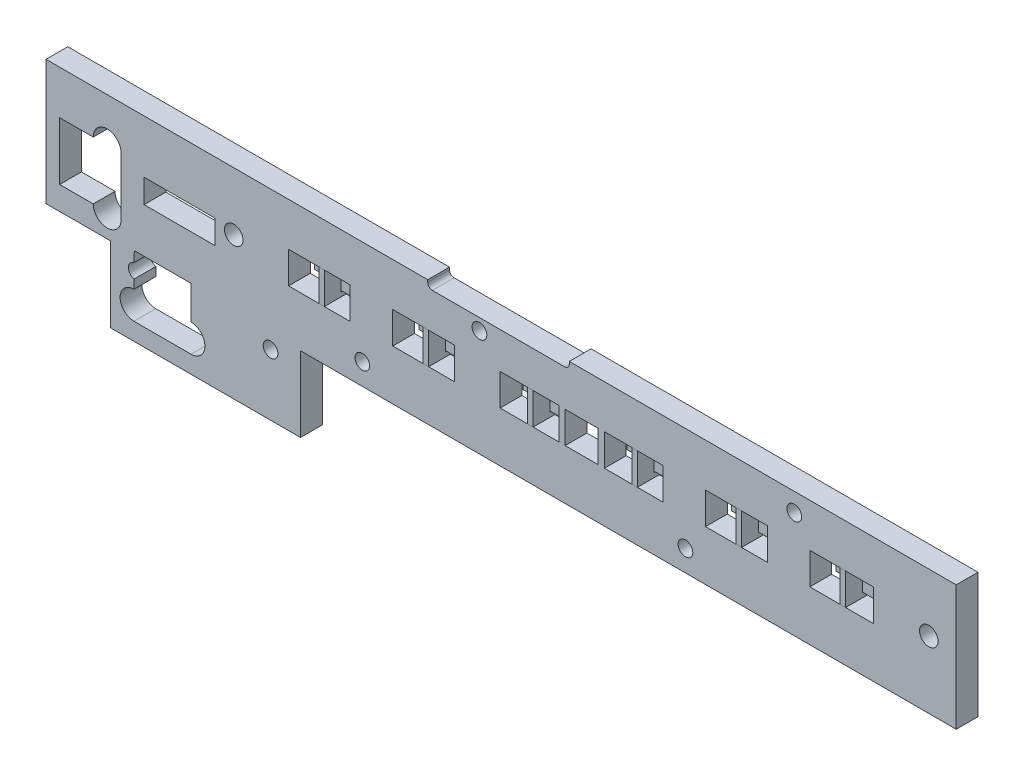
from build123d import *

# Parameters (mm, degrees)
SKETCH3_W                = 5.301042355
SKETCH3_H                = 4.976335083
SKETCH3_W_2              = 2.071088125
SKETCH3_H_2              = 1.171087983
BOSS_EXTRUDE1_DEPTH      = 0.5
SKETCH3_W_3              = 3.284612196
SKETCH3_H_3              = 2.771892244
SKETCH3_W_4              = 2.064576177
SKETCH3_H_4              = 1.177035148
BOSS_EXTRUDE1_2_DEPTH    = 0.5
SKETCH3_W_5              = 3.210448917
SKETCH3_W_6              = 2.071088022
SKETCH3_H_5              = 1.171088165
BOSS_EXTRUDE1_3_DEPTH    = 0.5
SKETCH3_W_7              = 5.259393958
BOSS_EXTRUDE1_4_DEPTH    = 0.5
SKETCH3_W_8              = 3.296125778
BOSS_EXTRUDE1_5_DEPTH    = 0.5
SKETCH3_W_9              = 5.387804014
SKETCH3_W_10             = 2.082129473
SKETCH3_H_6              = 1.187025756
BOSS_EXTRUDE1_6_DEPTH    = 0.5
SKETCH3_W_11             = 3.294189518
BOSS_EXTRUDE1_7_DEPTH    = 0.5
SKETCH3_W_12             = 5.32334234
BOSS_EXTRUDE1_8_DEPTH    = 0.5
SKETCH3_W_13             = 3.274022268
BOSS_EXTRUDE1_9_DEPTH    = 0.5
SKETCH3_W_14             = 5.322384917
BOSS_EXTRUDE1_10_DEPTH   = 0.5
SKETCH3_W_15             = 3.284431059
BOSS_EXTRUDE1_11_DEPTH   = 0.5
SKETCH3_W_16             = 5.344439457
BOSS_EXTRUDE1_12_DEPTH   = 0.5
SKETCH2_W                = 3.271099505
SKETCH2_H                = 2.803799576
SKETCH2_W_2              = 5.270708505
SKETCH2_H_2              = 4.922950418
SKETCH2_W_3              = 3.245423297
SKETCH2_W_4              = 5.320067722
SKETCH2_W_5              = 3.260073088
SKETCH2_W_6              = 5.330098587
SKETCH2_W_7              = 3.291692561
SKETCH2_W_8              = 5.246379357
SKETCH2_W_9              = 3.422743081
SKETCH2_H_3              = 2.964015375
SKETCH2_W_10             = 5.302284078
SKETCH2_H_4              = 4.906591237
SKETCH2_W_11             = 3.205112018
SKETCH2_H_5              = 2.730280607
SKETCH2_W_12             = 5.255002833
BOSS_EXTRUDE2_DEPTH      = 1
BOSS_EXTRUDE3_DEPTH      = 4.7
CUT_EXTRUDE7_DEPTH       = 169.783932724
CUT_EXTRUDE7_DEPTH_BACK  = 169.783932724
SKETCH6_R                = 2
SKETCH6_W                = 12.647169681
SKETCH6_H                = 6.84
SKETCH6_W_2              = 12.666711165
SKETCH6_W_3              = 13.361699613
SKETCH6_W_4              = 13.309643779
SKETCH6_W_5              = 13.356767641
SKETCH6_W_6              = 13.730259785
SKETCH16_W               = 1.2
SKETCH16_H               = 6.84000296
BOSS_EXTRUDE10_DEPTH     = 4.7
SKETCH16_H_2             = 6.84
BOSS_EXTRUDE10_2_DEPTH   = 4.7
BOSS_EXTRUDE10_3_DEPTH   = 4.7
BOSS_EXTRUDE10_4_DEPTH   = 4.7
BOSS_EXTRUDE10_5_DEPTH   = 4.7
BOSS_EXTRUDE10_6_DEPTH   = 4.7
SKETCH30_W               = 15.294534188
SKETCH30_H               = 5.125186255
CUT_EXTRUDE15_DEPTH      = 10
SKETCH33_W               = 13.927299819
SKETCH33_H               = 16.249335004
CUT_EXTRUDE17_DEPTH      = 10
CUT_EXTRUDE19_DEPTH      = 10
SKETCH36_W               = 1.2
SKETCH36_H               = 4.997567544
SKETCH36_H_2             = 5.361575032
SKETCH36_H_3             = 5.411450553
CUT_EXTRUDE23_DEPTH      = 1.1
SKETCH37_W               = 7.045350589
SKETCH37_H               = 6.785437309
CUT_EXTRUDE28_DEPTH      = 104.582708723
CUT_EXTRUDE30_DEPTH      = 104.582708723
CUT_EXTRUDE30_DEPTH_BACK = 104.582708723
SKETCH41_R               = 1.587
SKETCH42_W               = 30.549472815
SKETCH42_H               = 1.5
CUT_EXTRUDE31_DEPTH      = 104.582708723
FILLET2_R                = 1


with BuildPart() as part:
    # Sketch3 → Boss-Extrude1 (new body)
    with BuildSketch(Plane.XY):
        with Locations((-90.976469355, -40.789252701)):
            Rectangle(SKETCH3_W, SKETCH3_H)
        with Locations((-91.3883903, -40.757563148)):
            Rectangle(SKETCH3_W_2, SKETCH3_H_2, mode=Mode.SUBTRACT)
    extrude(amount=BOSS_EXTRUDE1_DEPTH)



with BuildPart() as body_2:
    # Sketch3 → Boss-Extrude1 2 (new body)
    with BuildSketch(Plane.XY):
        with Locations((-96.135246441, -40.785130507)):
            Rectangle(SKETCH3_W_3, SKETCH3_H_3)
        with Locations((-96.468707109, -40.757300223)):
            Rectangle(SKETCH3_W_4, SKETCH3_H_4, mode=Mode.SUBTRACT)
    extrude(amount=BOSS_EXTRUDE1_2_DEPTH)


with BuildPart() as body_3:
    # Sketch3 → Boss-Extrude1 3 (new body)
    with BuildSketch(Plane.XY):
        with Locations((-73.635994383, -40.785130507)):
            Rectangle(SKETCH3_W_5, SKETCH3_H_3)
        with Locations((-73.989388224, -40.757563148)):
            Rectangle(SKETCH3_W_6, SKETCH3_H_5, mode=Mode.SUBTRACT)
    extrude(amount=BOSS_EXTRUDE1_3_DEPTH)


with BuildPart() as body_4:
    # Sketch3 → Boss-Extrude1 4 (new body)
    with BuildSketch(Plane.XY):
        with Locations((-68.474479965, -40.789252701)):
            Rectangle(SKETCH3_W_7, SKETCH3_H)
        with Locations((-68.909386393, -40.757563148)):
            Rectangle(SKETCH3_W_2, SKETCH3_H_2, mode=Mode.SUBTRACT)
    extrude(amount=BOSS_EXTRUDE1_4_DEPTH)


with BuildPart() as body_5:
    # Sketch3 → Boss-Extrude1 5 (new body)
    with BuildSketch(Plane.XY):
        with Locations((-51.136068269, -40.785130507)):
            Rectangle(SKETCH3_W_8, SKETCH3_H_3)
        with Locations((-51.510399577, -40.757563148)):
            Rectangle(SKETCH3_W_2, SKETCH3_H_2, mode=Mode.SUBTRACT)
    extrude(amount=BOSS_EXTRUDE1_5_DEPTH)


with BuildPart() as body_6:
    # Sketch3 → Boss-Extrude1 6 (new body)
    with BuildSketch(Plane.XY):
        with Locations((-45.970813297, -40.789252701)):
            Rectangle(SKETCH3_W_9, SKETCH3_H)
        with Locations((-46.424861812, -40.765532034)):
            Rectangle(SKETCH3_W_10, SKETCH3_H_6, mode=Mode.SUBTRACT)
    extrude(amount=BOSS_EXTRUDE1_6_DEPTH)


with BuildPart() as body_7:
    # Sketch3 → Boss-Extrude1 7 (new body)
    with BuildSketch(Plane.XY):
        with Locations((-28.635547966, -40.785130507)):
            Rectangle(SKETCH3_W_11, SKETCH3_H_3)
        with Locations((-29.031395671, -40.757563148)):
            Rectangle(SKETCH3_W_2, SKETCH3_H_2, mode=Mode.SUBTRACT)
    extrude(amount=BOSS_EXTRUDE1_7_DEPTH)


with BuildPart() as body_8:
    # Sketch3 → Boss-Extrude1 8 (new body)
    with BuildSketch(Plane.XY):
        with Locations((-23.460783761, -40.789252701)):
            Rectangle(SKETCH3_W_12, SKETCH3_H)
        with Locations((-23.824394938, -40.757563148)):
            Rectangle(SKETCH3_W_2, SKETCH3_H_2, mode=Mode.SUBTRACT)
    extrude(amount=BOSS_EXTRUDE1_8_DEPTH)


with BuildPart() as body_9:
    # Sketch3 → Boss-Extrude1 9 (new body)
    with BuildSketch(Plane.XY):
        with Locations((-6.148230097, -40.785130507)):
            Rectangle(SKETCH3_W_13, SKETCH3_H_3)
        with Locations((-6.425377604, -40.757563148)):
            Rectangle(SKETCH3_W_2, SKETCH3_H_2, mode=Mode.SUBTRACT)
    extrude(amount=BOSS_EXTRUDE1_9_DEPTH)


with BuildPart() as body_10:
    # Sketch3 → Boss-Extrude1 10 (new body)
    with BuildSketch(Plane.XY):
        with Locations((-0.985348829, -40.789252701)):
            Rectangle(SKETCH3_W_14, SKETCH3_H)
        with Locations((-1.345391032, -40.757563148)):
            Rectangle(SKETCH3_W_2, SKETCH3_H_2, mode=Mode.SUBTRACT)
    extrude(amount=BOSS_EXTRUDE1_10_DEPTH)


with BuildPart() as body_11:
    # Sketch3 → Boss-Extrude1 11 (new body)
    with BuildSketch(Plane.XY):
        with Locations((16.356975138, -40.785130507)):
            Rectangle(SKETCH3_W_15, SKETCH3_H_3)
        with Locations((15.926612142, -40.757563148)):
            Rectangle(SKETCH3_W_2, SKETCH3_H_2, mode=Mode.SUBTRACT)
    extrude(amount=BOSS_EXTRUDE1_11_DEPTH)


with BuildPart() as body_12:
    # Sketch3 → Boss-Extrude1 12 (new body)
    with BuildSketch(Plane.XY):
        with Locations((21.506996131, -40.789252701)):
            Rectangle(SKETCH3_W_16, SKETCH3_H)
        with Locations((21.133612875, -40.757563148)):
            Rectangle(SKETCH3_W_6, SKETCH3_H_5, mode=Mode.SUBTRACT)
    extrude(amount=BOSS_EXTRUDE1_12_DEPTH)


with BuildPart() as part_1:
    add(part.part)

    add(body_2.part)  # Boss-Extrude2 merges body 2

    add(body_3.part)  # Boss-Extrude2 merges body 3

    add(body_4.part)  # Boss-Extrude2 merges body 4

    add(body_5.part)  # Boss-Extrude2 merges body 5

    add(body_6.part)  # Boss-Extrude2 merges body 6

    add(body_7.part)  # Boss-Extrude2 merges body 7

    add(body_8.part)  # Boss-Extrude2 merges body 8

    add(body_9.part)  # Boss-Extrude2 merges body 9

    add(body_10.part)  # Boss-Extrude2 merges body 10

    add(body_11.part)  # Boss-Extrude2 merges body 11

    add(body_12.part)  # Boss-Extrude2 merges body 12
    # Sketch2 → Boss-Extrude2 (add)
    with BuildSketch(Plane.XY):
        with Locations((-96.934502589, -40.780446006)):
            Rectangle(SKETCH2_W, SKETCH2_H)
        with Locations((-91.805070806, -40.796747166)):
            Rectangle(SKETCH2_W_2, SKETCH2_H_2)
        with Locations((-74.466851936, -40.780446006)):
            Rectangle(SKETCH2_W_3, SKETCH2_H)
        with Locations((-69.322704354, -40.796747166)):
            Rectangle(SKETCH2_W_4, SKETCH2_H_2)
        with Locations((-51.990168743, -40.780446006)):
            Rectangle(SKETCH2_W_5, SKETCH2_H)
        with Locations((-46.853306743, -40.796747166)):
            Rectangle(SKETCH2_W_6, SKETCH2_H_2)
        with Locations((-29.478440183, -40.780446006)):
            Rectangle(SKETCH2_W_7, SKETCH2_H)
        with Locations((-24.380617023, -40.796747166)):
            Rectangle(SKETCH2_W_8, SKETCH2_H_2)
        with Locations((-6.90621953, -40.860553905)):
            Rectangle(SKETCH2_W_9, SKETCH2_H_3)
        with Locations((-1.791889551, -40.937852006)):
            Rectangle(SKETCH2_W_10, SKETCH2_H_4)
        with Locations((15.519672272, -40.97742129)):
            Rectangle(SKETCH2_W_11, SKETCH2_H_5)
        with Locations((20.674006969, -40.937852006)):
            Rectangle(SKETCH2_W_12, SKETCH2_H_4)
    extrude(amount=BOSS_EXTRUDE2_DEPTH)


with BuildPart() as body_2_2:
    # Sketch4 → Boss-Extrude3 (new body)
    with BuildSketch(Plane.XY):
        Polygon((-118.251441201, -28.210668407), (43.582558799, -28.210668407), (43.582558799, -55.213760942), (-97.923260146, -55.213760942), (-97.923260146, -71.436353277), (-152.848857949, -71.436353277), (-152.848857949, -28.210668407), align=None)
    extrude(amount=BOSS_EXTRUDE3_DEPTH)

    # Sketch6 → Cut-Extrude7 (cut, two sides: drawn at the far end of the back side and taken through both)
    with BuildSketch(Plane.XY.offset(-CUT_EXTRUDE7_DEPTH_BACK)):
        with Locations((-112.332441201, -40.745938574)):
            Circle(SKETCH6_R)
        with Locations((37.662558799, -40.740938574)):
            Circle(SKETCH6_R)
        with Locations((-26.012911192, -40.97)):
            Rectangle(SKETCH6_W, SKETCH6_H)
        with Locations((-48.518014928, -40.97)):
            Rectangle(SKETCH6_W_2, SKETCH6_H)
        with Locations((-71.342914146, -40.97)):
            Rectangle(SKETCH6_W_3, SKETCH6_H)
        with Locations((-93.850919359, -40.97)):
            Rectangle(SKETCH6_W_4, SKETCH6_H)
        with Locations((-3.837563731, -40.97)):
            Rectangle(SKETCH6_W_5, SKETCH6_H)
        with Locations((18.851986371, -40.97)):
            Rectangle(SKETCH6_W_6, SKETCH6_H)
    extrude(amount=CUT_EXTRUDE7_DEPTH + CUT_EXTRUDE7_DEPTH_BACK, mode=Mode.SUBTRACT)

    # Sketch30 → Cut-Extrude15 (cut)
    with BuildSketch(Plane.XY.offset(4.7)):
        with Locations((-124.035260474, -42.235051052)):
            Rectangle(SKETCH30_W, SKETCH30_H)
    extrude(amount=-CUT_EXTRUDE15_DEPTH, mode=Mode.SUBTRACT)

    # Sketch33 → Cut-Extrude17 (cut)
    with BuildSketch(Plane.XY):
        with Locations((-145.88520804, -63.311685775)):
            Rectangle(SKETCH33_W, SKETCH33_H)
    extrude(amount=CUT_EXTRUDE17_DEPTH, mode=Mode.SUBTRACT)

    # Sketch34 → Cut-Extrude19 (cut)
    with BuildSketch(Plane(origin=(-55.959598534, -56.2386491, 5.930325309), x_dir=(-1, 0, 0), z_dir=(0, 0, -1))):
        with BuildLine():
            Line((80.69647956, 18.58740031), (80.69647956, 5.947305276))
            ThreePointArc((80.69647956, 5.947305276), (83.769967417, 3.097042676), (86.69649922, 6.097998539))
            Line((86.69649922, 6.097998539), (93.946478819, 6.097998539))
            Line((93.946478819, 6.097998539), (93.946478819, 18.587457917))
            Line((93.946478819, 18.587457917), (86.696478819, 18.587457917))
            ThreePointArc((86.696478819, 18.587457917), (83.696450013, 21.626278603), (80.69647956, 18.58740031))
        make_face()
        with BuildLine():
            Line((65.595255187, -11.441855017), (77.895255187, -11.441855017))
            ThreePointArc((77.895255187, -11.441855017), (80.895256244, -8.441853698), (77.895254662, -5.441852903))
            Line((77.895254662, -5.441852903), (77.841663995, 1.800985497))
            Line((77.841663995, 1.800985497), (65.595254662, 1.800985497))
            Line((65.595254662, 1.800985497), (65.595254662, -5.441855053))
            ThreePointArc((65.595254662, -5.441855053), (62.595255205, -8.441855297), (65.595255187, -11.441855017))
        make_face()
    extrude(amount=CUT_EXTRUDE19_DEPTH, mode=Mode.SUBTRACT)

    # Sketch37 → Cut-Extrude28 (cut, through all)
    with BuildSketch(Plane(origin=(-55.959598534, -56.2386491, 5.930325309), x_dir=(-1, 0, 0), z_dir=(0, 0, -1))):
        with Locations((-18.66501194, 15.240629264)):
            Rectangle(SKETCH37_W, SKETCH37_H)
    extrude(amount=CUT_EXTRUDE28_DEPTH, mode=Mode.SUBTRACT)

    # Sketch41 → Cut-Extrude30 (cut, two sides: drawn at the far end of the back side and taken through both)
    with BuildSketch(Plane(origin=(-55.959598534, -56.2386491, 5.930325309), x_dir=(-1, 0, 0), z_dir=(0, 0, -1)).offset(-CUT_EXTRUDE30_DEPTH_BACK)):
        with Locations((77.512977968, -1.988993967)):
            Circle(SKETCH41_R)
        with Locations((48.429977968, -1.988993967)):
            Circle(SKETCH41_R)
        with Locations((28.617977968, 5.631006033)):
            Circle(SKETCH41_R)
        with Locations((3.344977968, 24.046006033)):
            Circle(SKETCH41_R)
        with Locations((-41.105022032, 5.631006033)):
            Circle(SKETCH41_R)
        with Locations((-64.600022032, 24.046006033)):
            Circle(SKETCH41_R)
    extrude(amount=CUT_EXTRUDE30_DEPTH + CUT_EXTRUDE30_DEPTH_BACK, mode=Mode.SUBTRACT)

    # Sketch42 → Cut-Extrude31 (cut, through all)
    with BuildSketch(Plane(origin=(-55.959598534, -56.2386491, 5.930325309), x_dir=(-1, 0, 0), z_dir=(0, 0, -1))):
        with Locations((-0.7681346, 27.277980693)):
            Rectangle(SKETCH42_W, SKETCH42_H)
    extrude(amount=CUT_EXTRUDE31_DEPTH, mode=Mode.SUBTRACT)

    # Fillet2
    fillet2_edges = [body_2_2.edges().sort_by_distance(p)[0] for p in [
        (-39.916727527, -29.710668407, 2.35),
        (-70.466200342, -29.710668407, 2.35),
    ]]
    fillet(fillet2_edges, radius=FILLET2_R)


with BuildPart() as body_3_2:
    # Sketch16 → Boss-Extrude10 (new body)
    with BuildSketch(Plane.XY.offset(4.7)):
        with Locations((-93.375212371, -40.96999852)):
            Rectangle(SKETCH16_W, SKETCH16_H)
    extrude(amount=-BOSS_EXTRUDE10_DEPTH)


with BuildPart() as body_4_2:
    # Sketch16 → Boss-Extrude10 2 (new body)
    with BuildSketch(Plane.XY.offset(4.7)):
        with Locations((-70.879008215, -40.97)):
            Rectangle(SKETCH16_W, SKETCH16_H_2)
    extrude(amount=-BOSS_EXTRUDE10_2_DEPTH)


with BuildPart() as body_5_2:
    # Sketch16 → Boss-Extrude10 3 (new body)
    with BuildSketch(Plane.XY.offset(4.7)):
        with Locations((-48.323731749, -40.97)):
            Rectangle(SKETCH16_W, SKETCH16_H_2)
    extrude(amount=-BOSS_EXTRUDE10_3_DEPTH)


with BuildPart() as body_6_2:
    # Sketch16 → Boss-Extrude10 4 (new body)
    with BuildSketch(Plane.XY.offset(4.7)):
        with Locations((-25.820061476, -40.97)):
            Rectangle(SKETCH16_W, SKETCH16_H_2)
    extrude(amount=-BOSS_EXTRUDE10_4_DEPTH)


with BuildPart() as body_7_2:
    # Sketch16 → Boss-Extrude10 5 (new body)
    with BuildSketch(Plane.XY.offset(4.7)):
        with Locations((-3.337766654, -40.97)):
            Rectangle(SKETCH16_W, SKETCH16_H_2)
    extrude(amount=-BOSS_EXTRUDE10_5_DEPTH)


with BuildPart() as body_8_2:
    # Sketch16 → Boss-Extrude10 6 (new body)
    with BuildSketch(Plane.XY.offset(4.7)):
        with Locations((19.115939327, -40.97)):
            Rectangle(SKETCH16_W, SKETCH16_H_2)
    extrude(amount=-BOSS_EXTRUDE10_6_DEPTH)


with BuildPart() as cut_extrude23_tool:
    # Sketch36 → Cut-Extrude23 (new body)
    with BuildSketch(Plane(origin=(0, 0, 0), x_dir=(-1, 0, 0), z_dir=(0, 0, -1))):
        with Locations((-19.115939327, -40.950933669)):
            Rectangle(SKETCH36_W, SKETCH36_H)
        with Locations((3.337766654, -40.768929925)):
            Rectangle(SKETCH36_W, SKETCH36_H_2)
        with Locations((25.820061476, -40.768929925)):
            Rectangle(SKETCH36_W, SKETCH36_H_2)
        with Locations((48.323731749, -40.768929925)):
            Rectangle(SKETCH36_W, SKETCH36_H_2)
        with Locations((70.879008215, -40.768929925)):
            Rectangle(SKETCH36_W, SKETCH36_H_2)
        with Locations((93.375212371, -40.743992164)):
            Rectangle(SKETCH36_W, SKETCH36_H_3)
    extrude(amount=-CUT_EXTRUDE23_DEPTH)


with BuildPart() as body_3_2_1:
    add(body_3_2.part)

    # Cut-Extrude23: cut by cut_extrude23_tool
    add(cut_extrude23_tool.part, mode=Mode.SUBTRACT)


with BuildPart() as body_4_2_1:
    add(body_4_2.part)

    # Cut-Extrude23: cut by cut_extrude23_tool
    add(cut_extrude23_tool.part, mode=Mode.SUBTRACT)


with BuildPart() as body_5_2_1:
    add(body_5_2.part)

    # Cut-Extrude23: cut by cut_extrude23_tool
    add(cut_extrude23_tool.part, mode=Mode.SUBTRACT)


with BuildPart() as body_6_2_1:
    add(body_6_2.part)

    # Cut-Extrude23: cut by cut_extrude23_tool
    add(cut_extrude23_tool.part, mode=Mode.SUBTRACT)


with BuildPart() as body_7_2_1:
    add(body_7_2.part)

    # Cut-Extrude23: cut by cut_extrude23_tool
    add(cut_extrude23_tool.part, mode=Mode.SUBTRACT)


with BuildPart() as body_8_2_1:
    add(body_8_2.part)

    # Cut-Extrude23: cut by cut_extrude23_tool
    add(cut_extrude23_tool.part, mode=Mode.SUBTRACT)


solid = Compound([part_1.part, body_2_2.part, body_3_2_1.part, body_4_2_1.part, body_5_2_1.part, body_6_2_1.part, body_7_2_1.part, body_8_2_1.part])
